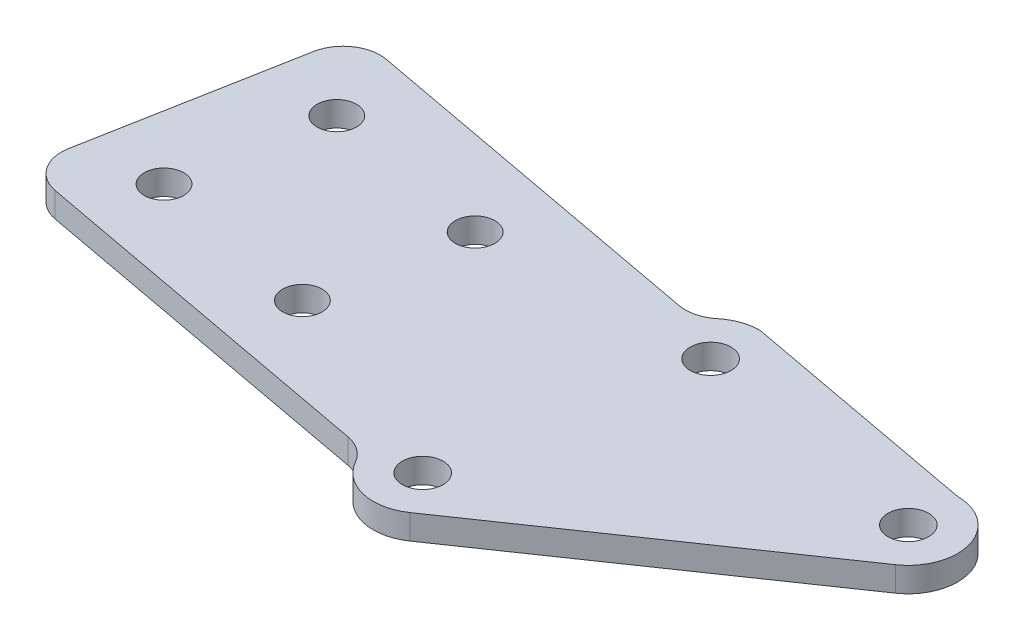
from build123d import *

# Parameters (mm, degrees)
SKETCH1_R           = 1.650000007
BOSS_EXTRUDE1_DEPTH = 1
SKETCH7_R           = 1.6
CUT_EXTRUDE2_DEPTH  = 2


with BuildPart() as part:
    # Sketch1 → Boss-Extrude1 (new, symmetric)
    with BuildSketch(Plane(origin=(0, 0, 0), x_dir=(1, 0, 0), z_dir=(0, 1, 0))):
        with BuildLine():
            Line((-56.656859897, 90.483506167), (-36.993673105, 86.828497938))
            ThreePointArc((-36.993673105, 86.828497938), (-33.173282872, 84.013663947), (-34.729774781, 79.530807173))
            Line((-34.729774781, 79.530807173), (-58.047969803, 63.522628609))
            ThreePointArc((-58.047969803, 63.522628609), (-61.213536363, 62.923269927), (-63.79414326, 64.852132418))
            ThreePointArc((-63.79414326, 64.852132418), (-64.662572796, 65.817505246), (-65.857598376, 66.32547022))
            Line((-65.857598376, 66.32547022), (-94.996570641, 71.741844715))
            ThreePointArc((-94.996570641, 71.741844715), (-96.92158748, 72.993398991), (-97.397797425, 75.239573968))
            Line((-97.397797425, 75.239573968), (-94.29104043, 91.953282742))
            ThreePointArc((-94.29104043, 91.953282742), (-93.039486154, 93.878299581), (-90.793311177, 94.354509526))
            Line((-90.793311177, 94.354509526), (-61.654338999, 88.938135048))
            ThreePointArc((-61.654338999, 88.938135048), (-60.356600681, 88.982743171), (-59.199275822, 89.571567253))
            ThreePointArc((-59.199275822, 89.571567253), (-58.007370108, 90.248625312), (-56.656859897, 90.483506167))
        make_face()
        with Locations(Location((-56.656859897, 86.483506167, 0), (0, 0, 270))):
            Circle(SKETCH1_R, mode=Mode.SUBTRACT)
        with Locations(Location((-36.993673105, 82.828497938, 0), (0, 0, 270))):
            Circle(SKETCH1_R, mode=Mode.SUBTRACT)
        with Locations(Location((-60.311868127, 66.820319374, 0), (0, 0, 270))):
            Circle(SKETCH1_R, mode=Mode.SUBTRACT)
    extrude(amount=BOSS_EXTRUDE1_DEPTH, both=True)

    # Sketch7 → Cut-Extrude2 (cut)
    with BuildSketch(Plane(origin=(0, 1, 0), x_dir=(1, 0, 0), z_dir=(0, 1, 0))):
        with Locations(Location((-88.848960421, 88.398881924, 0), (0, 0, 270))):
            Circle(SKETCH7_R)
        with Locations(Location((-91.041965359, 76.600969848, 0), (0, 0, 270))):
            Circle(SKETCH7_R)
        with Locations(Location((-75.084729666, 85.840376163, 0), (0, 0, 270))):
            Circle(SKETCH7_R)
        with Locations(Location((-77.277734604, 74.042464088, 0), (0, 0, 270))):
            Circle(SKETCH7_R)
    extrude(amount=-CUT_EXTRUDE2_DEPTH, mode=Mode.SUBTRACT)


solid = part.part
